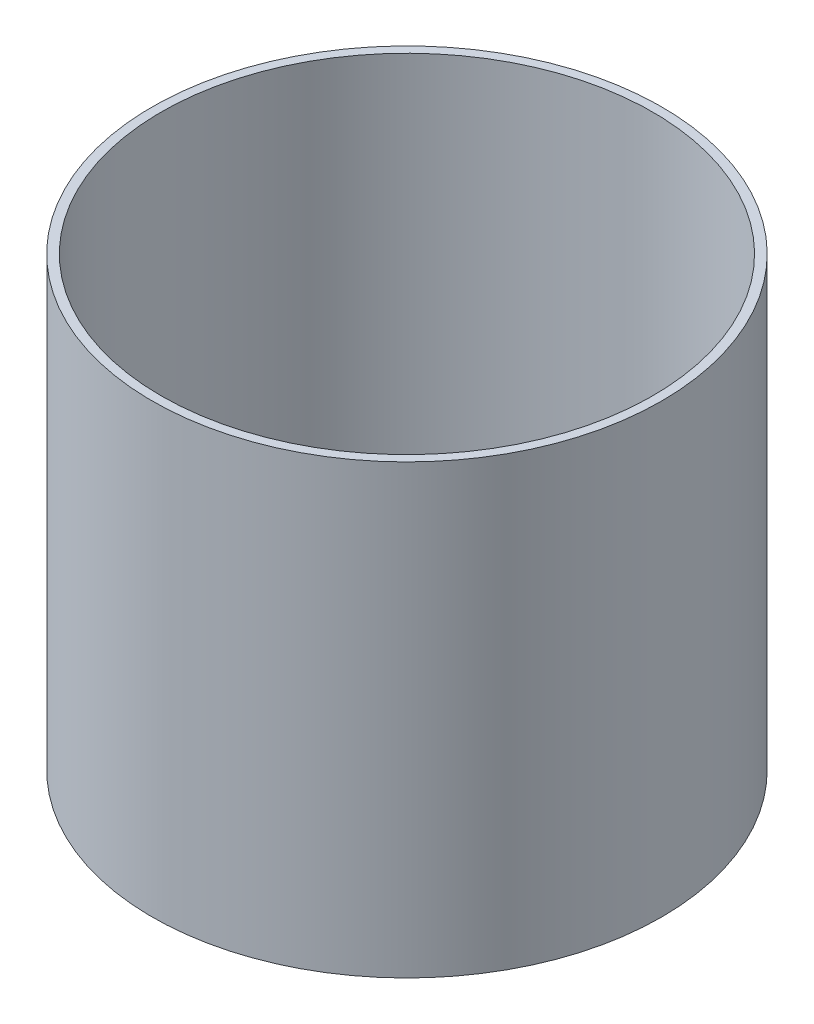
from build123d import *

# Parameters (mm, degrees)
CROQUIS1_R            = 5.7
CROQUIS1_R_2          = 5.5
EXTRUIR_L_MINA1_DEPTH = 10


with BuildPart() as part:
    # Croquis1 → Extruir-Lámina1 (new body)
    with BuildSketch(Plane(origin=(0, 0, 0), x_dir=(1, 0, 0), z_dir=(0, 1, 0))):
        Circle(CROQUIS1_R)
        Circle(CROQUIS1_R_2, mode=Mode.SUBTRACT)
    extrude(amount=EXTRUIR_L_MINA1_DEPTH)


solid = part.part
